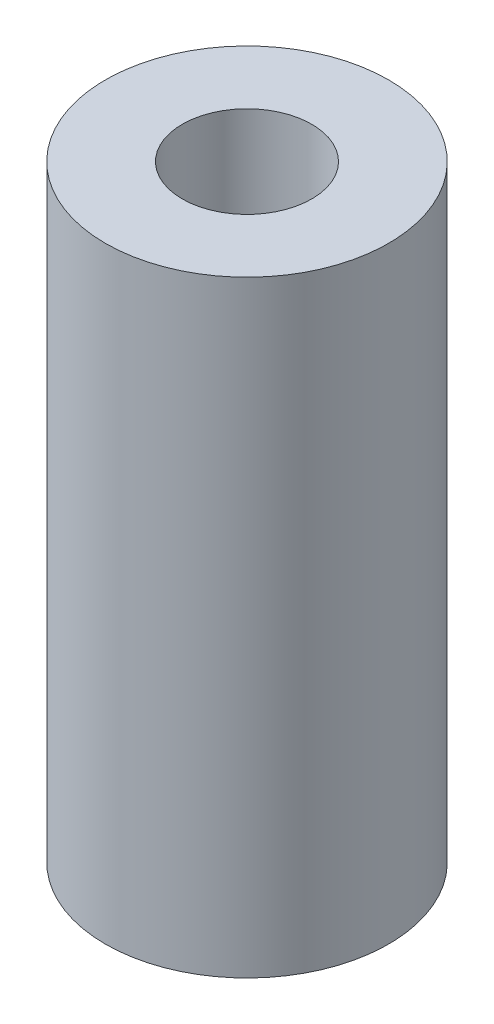
from build123d import *

# Parameters (mm, degrees)
ESBO_O1_R                = 3.5
ESBO_O1_R_2              = 1.6
RESSALTO_EXTRUS_O1_DEPTH = 7.5


with BuildPart() as part:
    # Esboço1 → Ressalto-extrusão1 (new, symmetric)
    with BuildSketch(Plane(origin=(0, 0, 0), x_dir=(1, 0, 0), z_dir=(0, 1, 0))):
        with Locations(Location((0, 0, 0), (0, 0, 270))):
            Circle(ESBO_O1_R)
        with Locations(Location((0, 0, 0), (0, 0, 270))):
            Circle(ESBO_O1_R_2, mode=Mode.SUBTRACT)
    extrude(amount=RESSALTO_EXTRUS_O1_DEPTH, both=True)


solid = part.part
